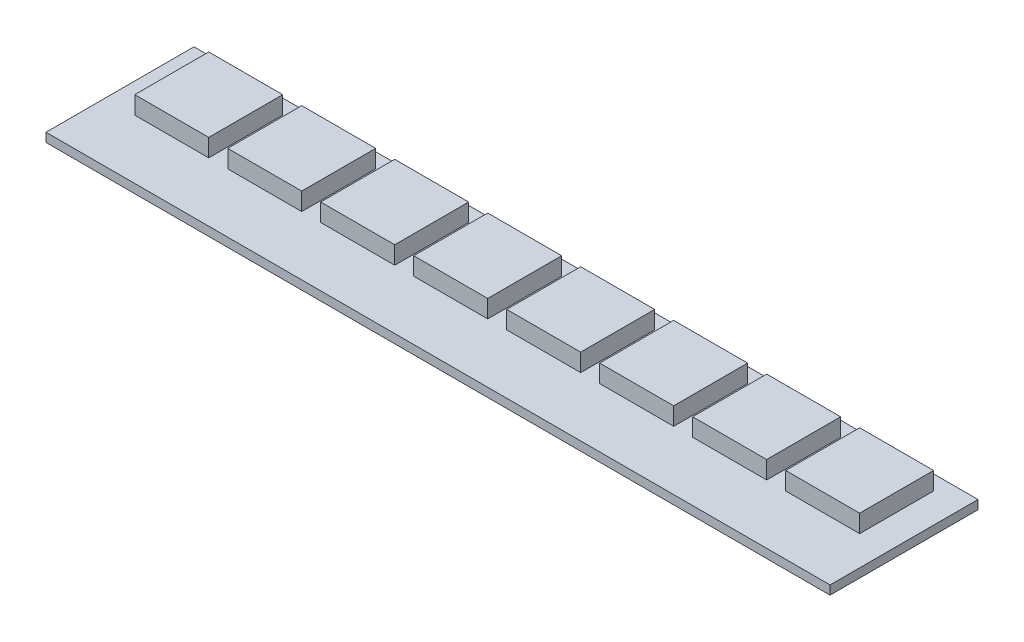
from build123d import *

# Parameters (mm, degrees)
SKETCH1_W           = 10
SKETCH1_H           = 0.6
BOSS_EXTRUDE1_DEPTH = 26.5
SKETCH2_W           = 5
SKETCH2_H           = 5
BOSS_EXTRUDE2_DEPTH = 1.2


with BuildPart() as part:
    # Sketch1 → Boss-Extrude1 (new, symmetric)
    with BuildSketch(Plane(origin=(0, 0, 0), x_dir=(0, 0, -1), z_dir=(1, 0, 0))):
        Rectangle(SKETCH1_W, SKETCH1_H)
    extrude(amount=BOSS_EXTRUDE1_DEPTH, both=True)

    # Sketch2 → Boss-Extrude2 (add)
    with BuildSketch(Plane(origin=(0, 0.3, 0), x_dir=(1, 0, 0), z_dir=(0, 1, 0))):
        with Locations((-15.714285714, 1.5)):
            Rectangle(SKETCH2_W, SKETCH2_H)
        with Locations((-22, 1.5)):
            Rectangle(SKETCH2_W, SKETCH2_H)
        with Locations((-9.428571429, 1.5)):
            Rectangle(SKETCH2_W, SKETCH2_H)
        with Locations((-3.142857143, 1.5)):
            Rectangle(SKETCH2_W, SKETCH2_H)
        with Locations((3.142857143, 1.5)):
            Rectangle(SKETCH2_W, SKETCH2_H)
        with Locations((9.428571429, 1.5)):
            Rectangle(SKETCH2_W, SKETCH2_H)
        with Locations((15.714285714, 1.5)):
            Rectangle(SKETCH2_W, SKETCH2_H)
        with Locations((22, 1.5)):
            Rectangle(SKETCH2_W, SKETCH2_H)
    extrude(amount=BOSS_EXTRUDE2_DEPTH)


solid = part.part
